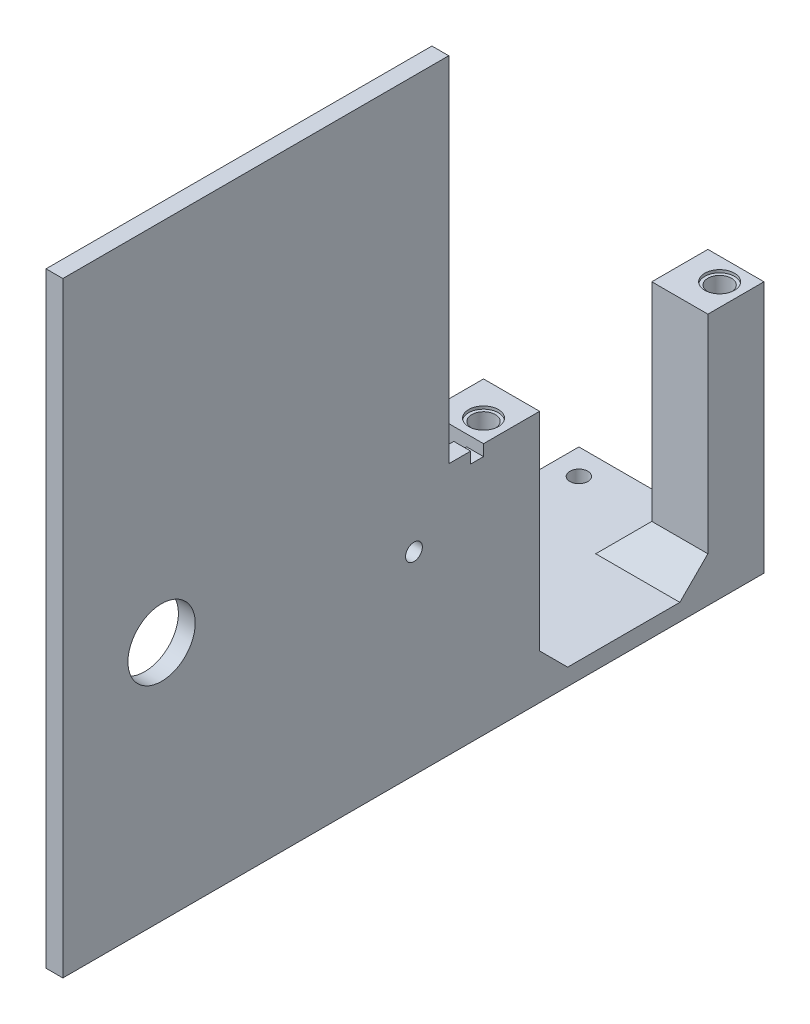
from build123d import *

# Parameters (mm, degrees)
SKETCH1_R           = 1.6
BOSS_EXTRUDE1_DEPTH = 3
SKETCH2_W           = 10
SKETCH2_H           = 10
BOSS_EXTRUDE2_DEPTH = 42
CHAMFER1_SIZE       = 5
SKETCH3_R           = 2.1
CUT_EXTRUDE1_DEPTH  = 52
SKETCH4_R           = 2.65
CUT_EXTRUDE2_DEPTH  = 0.5
SKETCH5_W           = 3
SKETCH5_H           = 43
BOSS_EXTRUDE3_DEPTH = 75
SKETCH6_W           = 3
SKETCH6_H           = 3.9
BOSS_EXTRUDE4_DEPTH = 2
SKETCH7_W           = 3
SKETCH7_H           = 68.8
BOSS_EXTRUDE5_DEPTH = 5
SKETCH8_R           = 1.5
CUT_EXTRUDE3_DEPTH  = 5
SKETCH9_W           = 3
SKETCH9_H           = 68.8
BOSS_EXTRUDE6_DEPTH = 15
SKETCH10_R          = 6
CUT_EXTRUDE4_DEPTH  = 10
SKETCH11_W          = 3
SKETCH11_H          = 68.8
BOSS_EXTRUDE7_DEPTH = 45


with BuildPart() as part:
    # Sketch1 → Boss-Extrude1 (new body)
    with BuildSketch(Plane(origin=(0, 0, 0), x_dir=(1, 0, 0), z_dir=(0, 1, 0))):
        Polygon((-6.512396694, 9.685950413), (1.487603306, 9.685950413), (26.487603306, 9.685950413), (26.487603306, -40.314049587), (1.487603306, -40.314049587), (-6.512396694, -40.314049587), align=None)
        with Locations(Location((-1.962396694, -35.764049587, 0), (0, 0, 270))):
            Circle(SKETCH1_R, mode=Mode.SUBTRACT)
        with Locations(Location((-1.962396694, 5.135950413, 0), (0, 0, 270))):
            Circle(SKETCH1_R, mode=Mode.SUBTRACT)
    extrude(amount=BOSS_EXTRUDE1_DEPTH)

    # Sketch2 → Boss-Extrude2 (add)
    with BuildSketch(Plane(origin=(0, 3, 0), x_dir=(1, 0, 0), z_dir=(0, 1, 0))):
        with Locations((21.487603306, -35.314049587)):
            Rectangle(SKETCH2_W, SKETCH2_H)
        with Locations((21.487603306, 4.685950413)):
            Rectangle(SKETCH2_W, SKETCH2_H)
    extrude(amount=BOSS_EXTRUDE2_DEPTH)

    # Chamfer1
    chamfer1_edges = [part.edges().sort_by_distance(p)[0] for p in [
        (21.487603306, 3, 30.314049587),
        (16.487603306, 3, 35.314049587),
        (16.487603306, 3, -4.685950413),
        (21.487603306, 3, 0.314049587),
    ]]
    chamfer(chamfer1_edges, length=CHAMFER1_SIZE)

    # Sketch3 → Cut-Extrude1 (cut)
    with BuildSketch(Plane(origin=(0, 45, 0), x_dir=(1, 0, 0), z_dir=(0, 1, 0))):
        with Locations(Location((22.537603306, -36.364049587, 0), (0, 0, 270))):
            Circle(SKETCH3_R)
        with Locations(Location((22.537603306, 5.735950413, 0), (0, 0, 270))):
            Circle(SKETCH3_R)
    extrude(amount=-CUT_EXTRUDE1_DEPTH, mode=Mode.SUBTRACT)

    # Sketch4 → Cut-Extrude2 (cut)
    with BuildSketch(Plane(origin=(0, 45, 0), x_dir=(1, 0, 0), z_dir=(0, 1, 0))):
        with Locations(Location((22.537603306, -36.364049587, 0), (0, 0, 270))):
            Circle(SKETCH4_R)
        with Locations(Location((22.537603306, 5.735950413, 0), (0, 0, 270))):
            Circle(SKETCH4_R)
    cut_extrude2 = extrude(amount=-CUT_EXTRUDE2_DEPTH, mode=Mode.SUBTRACT)

    # Mirror1: Cut-Extrude2 across plane
    add(cut_extrude2.mirror(Plane(origin=(0, 22.5, 0), x_dir=(0, 0, 1), z_dir=(0, -1, 0))), mode=Mode.SUBTRACT)

    # Sketch5 → Boss-Extrude3 (add)
    with BuildSketch(Plane.XY.offset(40.314049587)):
        with Locations((24.987603306, 21.5)):
            Rectangle(SKETCH5_W, SKETCH5_H)
    extrude(amount=BOSS_EXTRUDE3_DEPTH)

    # Sketch6 → Boss-Extrude4 (add)
    with BuildSketch(Plane(origin=(0, 43, 0), x_dir=(1, 0, 0), z_dir=(0, 1, 0))):
        with Locations((24.987603306, -44.564049587)):
            Rectangle(SKETCH6_W, SKETCH6_H)
    extrude(amount=BOSS_EXTRUDE4_DEPTH)

    # Sketch7 → Boss-Extrude5 (add)
    with BuildSketch(Plane(origin=(0, 43, 0), x_dir=(1, 0, 0), z_dir=(0, 1, 0))):
        with Locations((24.987603306, -80.914049587)):
            Rectangle(SKETCH7_W, SKETCH7_H)
    extrude(amount=BOSS_EXTRUDE5_DEPTH)

    # Sketch8 → Cut-Extrude3 (cut)
    with BuildSketch(Plane.ZY.offset(-23.487603306)):
        with Locations(Location((52.714049587, 34.5, 0), (0, 0, 270))):
            Circle(SKETCH8_R)
    extrude(amount=-CUT_EXTRUDE3_DEPTH, mode=Mode.SUBTRACT)

    # Sketch9 → Boss-Extrude6 (add)
    with BuildSketch(Plane(origin=(0, 48, 0), x_dir=(1, 0, 0), z_dir=(0, 1, 0))):
        with Locations((24.987603306, -80.914049587)):
            Rectangle(SKETCH9_W, SKETCH9_H)
    extrude(amount=BOSS_EXTRUDE6_DEPTH)

    # Sketch10 → Cut-Extrude4 (cut)
    with BuildSketch(Plane.ZY.offset(-23.487603306)):
        with Locations(Location((97.714049587, 43, 0), (0, 0, 270))):
            Circle(SKETCH10_R)
    extrude(amount=-CUT_EXTRUDE4_DEPTH, mode=Mode.SUBTRACT)

    # Sketch11 → Boss-Extrude7 (add)
    with BuildSketch(Plane(origin=(0, 63, 0), x_dir=(1, 0, 0), z_dir=(0, 1, 0))):
        with Locations((24.987603306, -80.914049587)):
            Rectangle(SKETCH11_W, SKETCH11_H)
    extrude(amount=BOSS_EXTRUDE7_DEPTH)


solid = part.part
